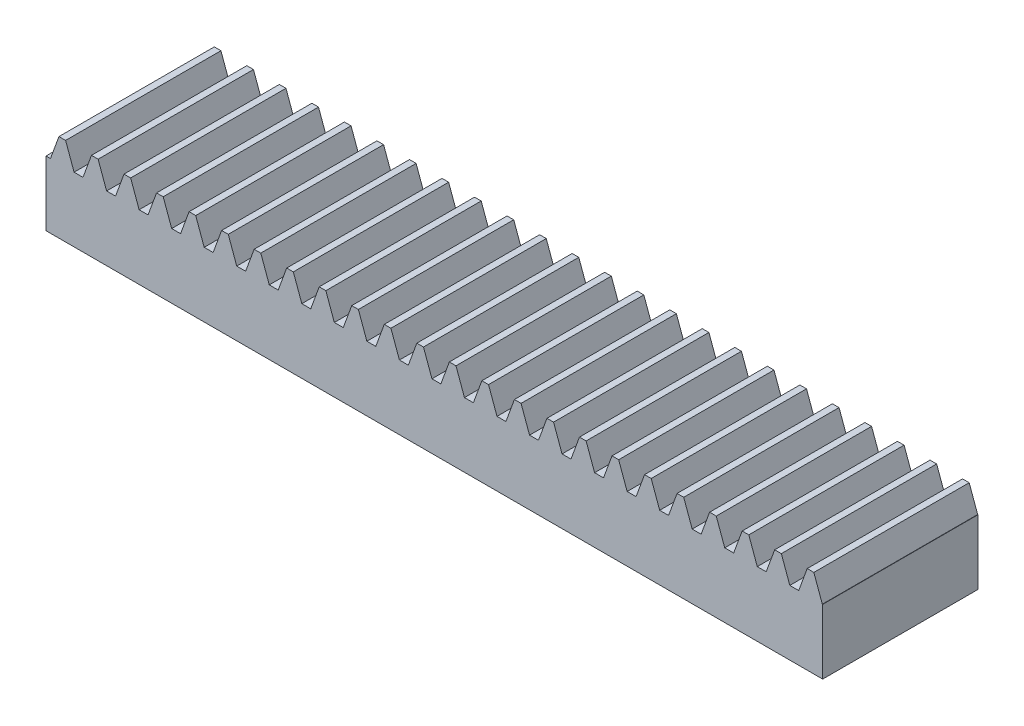
from build123d import *

# Parameters (mm, degrees)
BLANKSKE_W        = 150
BLANKSKE_H        = 17
BLANK_DEPTH       = 30
TOOTHCUTSIM_DEPTH = 154.912312698
TEETHCUTS_COUNT   = 25
TEETHCUTS_PITCH   = 6.2831853


with BuildPart() as part:
    # BlankSke → Blank (new body)
    with BuildSketch(Plane.XY):
        with Locations((75, 8.5)):
            Rectangle(BLANKSKE_W, BLANKSKE_H)
    extrude(amount=-BLANK_DEPTH)

    # TooCutSkeSim → ToothCutSim (cut, through all)
    with BuildSketch(Plane.XY):
        Polygon((0.861870739, 12.5), (-0.861870739, 12.5), (-2.508981637, 17.0254), (2.508981637, 17.0254), align=None)
    toothcutsim = extrude(amount=-TOOTHCUTSIM_DEPTH, mode=Mode.SUBTRACT)

    # TeethCuts: ToothCutSim ×25
    with Locations(*[(i * TEETHCUTS_PITCH, 0, 0) for i in range(1, TEETHCUTS_COUNT)]):
        add(toothcutsim, mode=Mode.SUBTRACT)


solid = part.part
